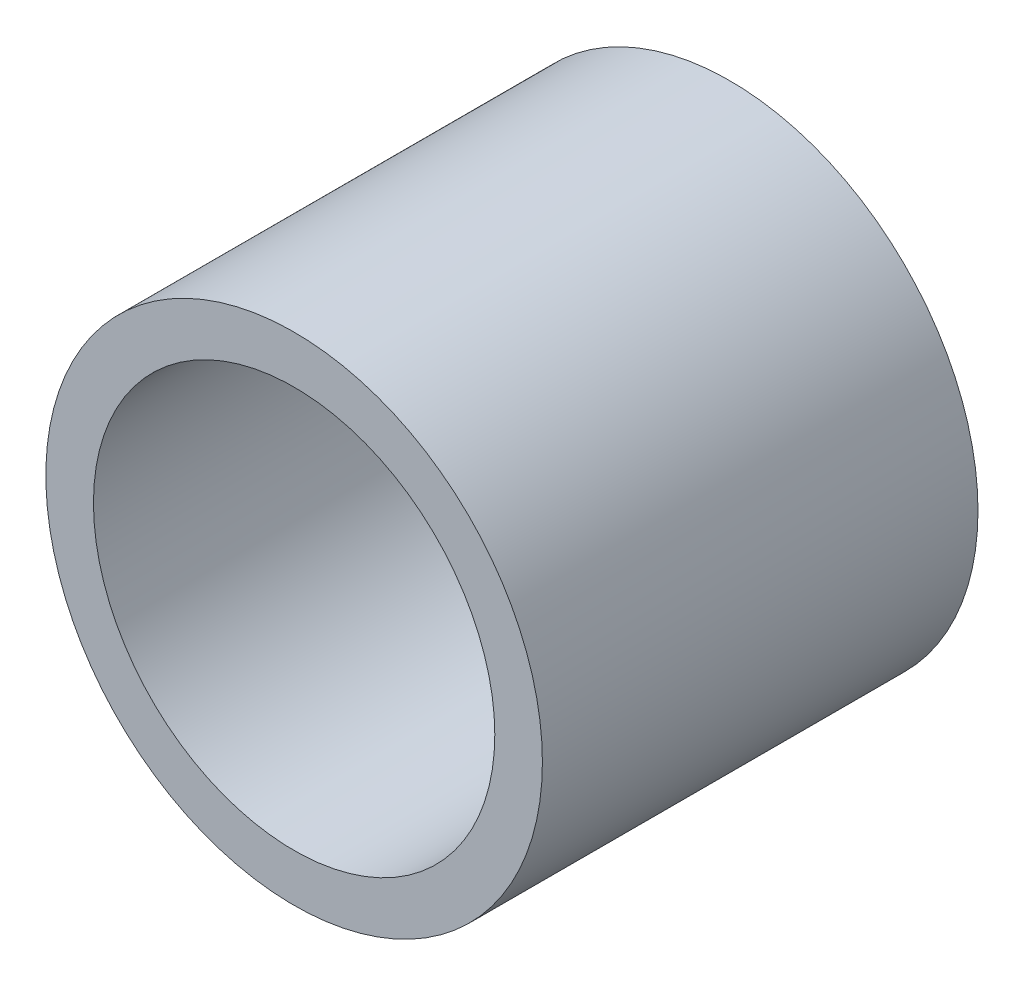
from build123d import *

# Parameters (mm, degrees)
ADAPTER_8OD_6P45ID_PROFILE_R   = 3.99
ADAPTER_8OD_6P45ID_PROFILE_R_2 = 3.225
ADAPTER_8OD_6P45ID_DEPTH       = 7


with BuildPart() as part:
    # Adapter_8OD_6p45ID_profile → Adapter_8OD_6p45ID (new body)
    with BuildSketch(Plane.XY):
        Circle(ADAPTER_8OD_6P45ID_PROFILE_R)
        Circle(ADAPTER_8OD_6P45ID_PROFILE_R_2, mode=Mode.SUBTRACT)
    extrude(amount=ADAPTER_8OD_6P45ID_DEPTH)


solid = part.part
